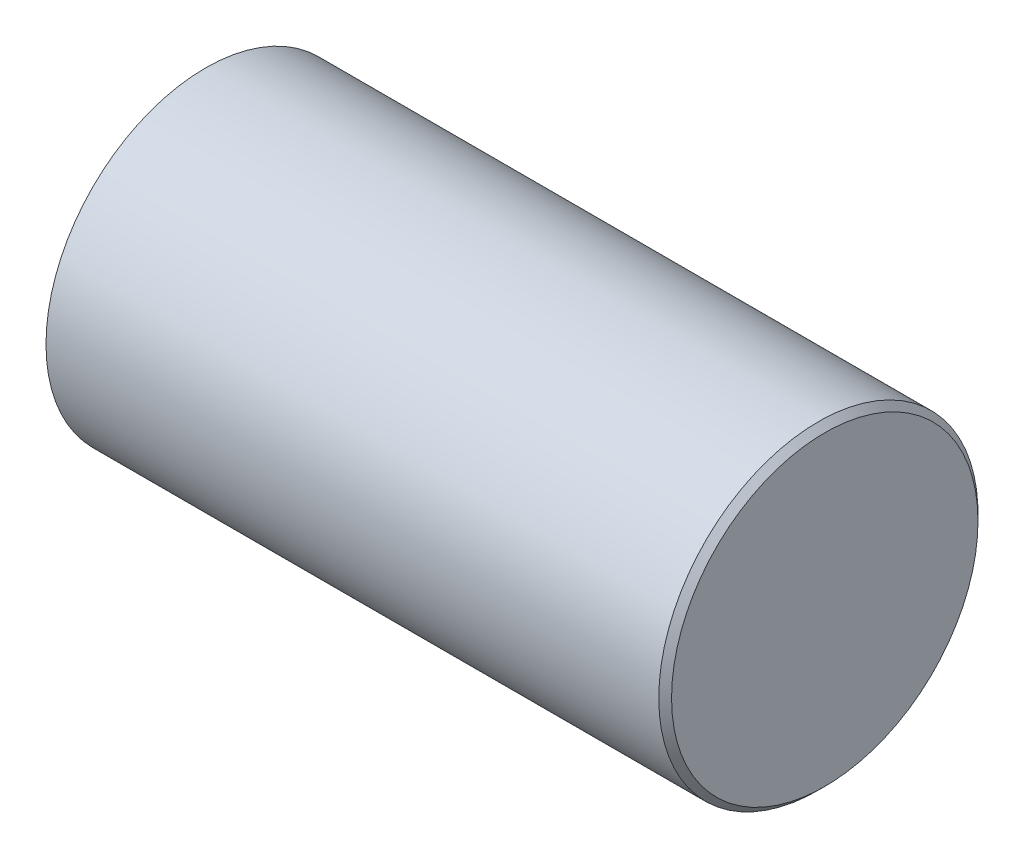
from build123d import *

# Parameters (mm, degrees)
CHAMFER1_SIZE = 1


with BuildPart() as part:
    # Sketch1 → Revolve1 (revolve)
    with BuildSketch(Plane.XY, mode=Mode.PRIVATE) as revolve1_sk:
        with BuildLine():
            ThreePointArc((3.019609728, 25), (0.757635823, 12.590850278), (0, 0))
            Line((0, 0), (100, 0))
            Line((100, 0), (100, 25))
            Line((100, 25), (3.019609728, 25))
        make_face()
    revolve(revolve1_sk.sketch.rotate(Axis((0, 0, 0), (1, 0, 0)), 90), axis=Axis((0, 0, 0), (1, 0, 0)))

    # Chamfer1
    chamfer1_edges = [part.edges().sort_by_distance(p)[0] for p in [
        (100, 0, -25),
    ]]
    chamfer(chamfer1_edges, length=CHAMFER1_SIZE)


solid = part.part
